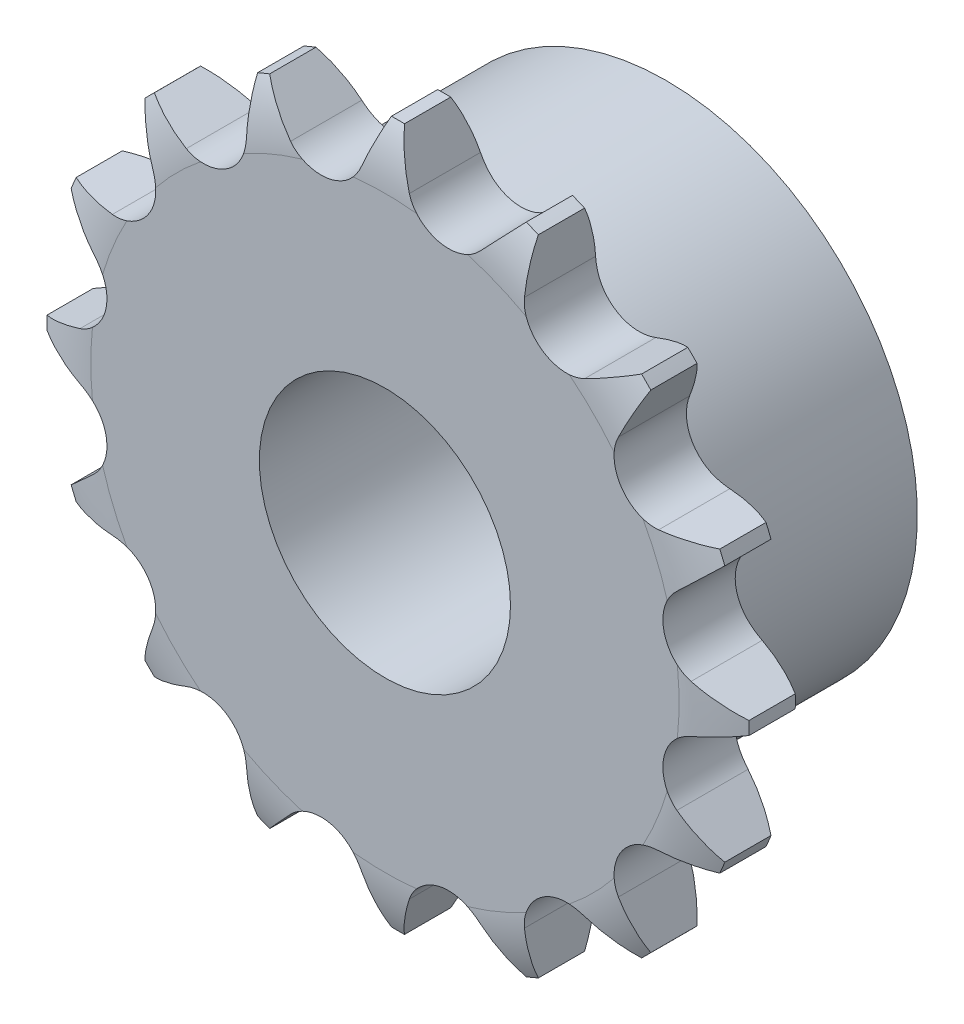
from build123d import *

# Parameters (mm, degrees)
CUT_EXTRUDE_1_DEPTH      = 57.806733756
PATTERN_CIRCULAR_1_COUNT = 16
SKETCH_14_R              = 12.5
CUT_EXTRUDE_5_DEPTH      = 46


with BuildPart() as part:
    # 草图4 → 旋转1 (revolve)
    with BuildSketch(Plane(origin=(0, 0, 0), x_dir=(0, 0, -1), z_dir=(1, 0, 0))):
        with BuildLine():
            Line((0, 25), (-20.8, 25))
            Line((-20.8, 25), (-20.8, 29.283431373))
            ThreePointArc((-20.8, 29.283431373), (-21.129167352, 32.190319744), (-22.1, 34.95))
            Line((-22.1, 34.95), (-26.7, 34.95))
            ThreePointArc((-26.7, 34.95), (-27.670832648, 32.190319744), (-28, 29.283431373))
            Line((-28, 29.283431373), (-28, 6))
            Line((-28, 6), (0, 6))
            Line((0, 6), (0, 25))
        make_face()
    revolve(axis=Axis((0, 0, 0), (0, 0, 1)))

    # 草图5 → 切除-拉伸1 (cut, through all)
    with BuildSketch(Plane.XY):
        with BuildLine():
            Line((0.65, 34.943955128), (2.372725822, 30.412542083))
            ThreePointArc((2.372725822, 30.412542083), (5.519915515, 27.751352358), (9.445917947, 29.00564045))
            Line((9.445917947, 29.00564045), (12.77156379, 32.532901167))
            ThreePointArc((12.77156379, 32.532901167), (6.818202765, 34.278486125), (0.65, 34.943955128))
        make_face()
    cut_extrude_1 = extrude(amount=CUT_EXTRUDE_1_DEPTH, mode=Mode.SUBTRACT)

    # 阵列(圆周)1: 切除-拉伸1 ×16 about axis
    pattern_circular_1_axis = Axis((0, 0, 0), (0, 0, 1))
    for i in range(1, PATTERN_CIRCULAR_1_COUNT):
        add(cut_extrude_1.rotate(pattern_circular_1_axis, i * 360 / PATTERN_CIRCULAR_1_COUNT), mode=Mode.SUBTRACT)

    # 草图14 → 切除-拉伸5 (cut)
    with BuildSketch(Plane.XY.offset(28)):
        Circle(SKETCH_14_R)
    extrude(amount=-CUT_EXTRUDE_5_DEPTH, mode=Mode.SUBTRACT)


solid = part.part
